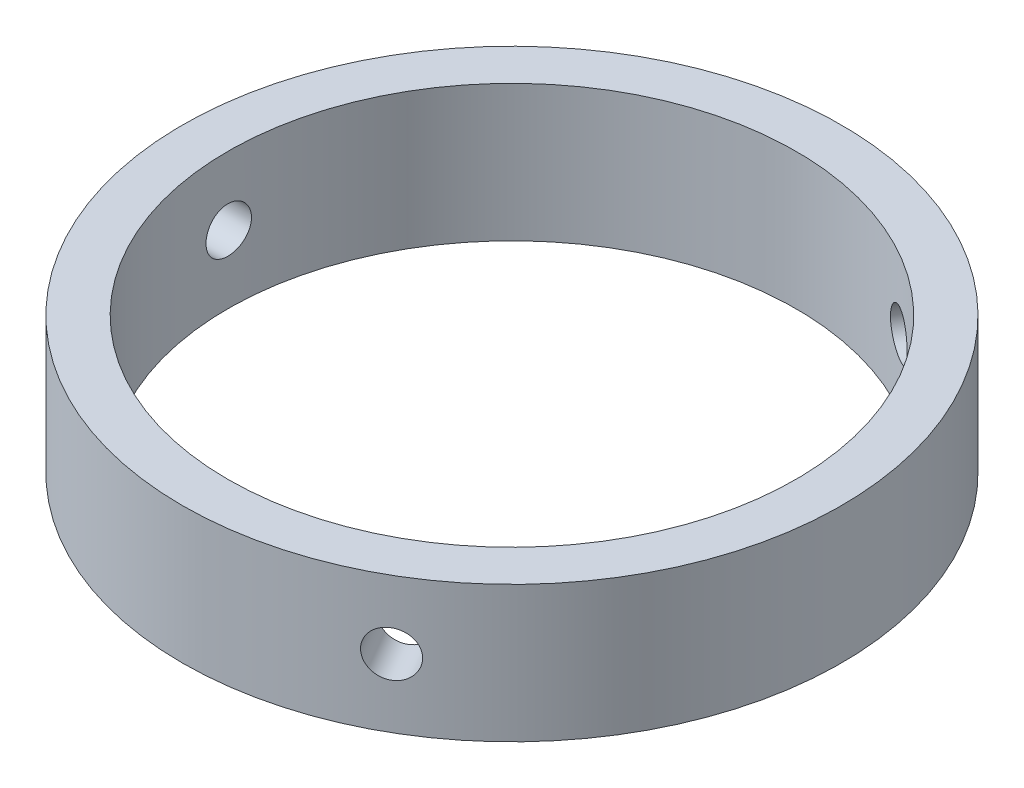
from build123d import *

# Parameters (mm, degrees)
SKETCH1_R           = 46.0375
SKETCH1_R_2         = 39.6875
BOSS_EXTRUDE1_DEPTH = 19.05
SKETCH4_R           = 3.175
CUT_EXTRUDE1_DEPTH  = 76.2
SKETCH5_R           = 3.175
CUT_EXTRUDE2_DEPTH  = 76.2
SKETCH3_R           = 3.175
CUT_EXTRUDE3_DEPTH  = 76.2


with BuildPart() as part:
    # Sketch1 → Boss-Extrude1 (new body)
    with BuildSketch(Plane(origin=(0, 0, 0), x_dir=(1, 0, 0), z_dir=(0, 1, 0))):
        with Locations(Location((0, 0, 0), (0, 0, 90))):
            Circle(SKETCH1_R)
        with Locations(Location((0, 0, 0), (0, 0, 90))):
            Circle(SKETCH1_R_2, mode=Mode.SUBTRACT)
    extrude(amount=BOSS_EXTRUDE1_DEPTH)

    # Sketch4 → Cut-Extrude1 (cut)
    with BuildSketch(Plane(origin=(0, 0, 0), x_dir=(0.8660254037844364, 0, 0.500000000000004), z_dir=(-0.500000000000004, 0, 0.8660254037844365))):
        with Locations((0, 9.525)):
            Circle(SKETCH4_R)
    extrude(amount=-CUT_EXTRUDE1_DEPTH, mode=Mode.SUBTRACT)

    # Sketch5 → Cut-Extrude2 (cut)
    with BuildSketch(Plane(origin=(0, 0, 0), x_dir=(-0.8660254037844363, 0, 0.5000000000000043), z_dir=(-0.5000000000000043, 0, -0.8660254037844363))):
        with Locations((0, 9.525)):
            Circle(SKETCH5_R)
    extrude(amount=-CUT_EXTRUDE2_DEPTH, mode=Mode.SUBTRACT)

    # Sketch3 → Cut-Extrude3 (cut)
    with BuildSketch(Plane(origin=(0, 0, 0), x_dir=(0, 0, -1), z_dir=(1, 0, 0))):
        with Locations((0, 9.525)):
            Circle(SKETCH3_R)
    extrude(amount=-CUT_EXTRUDE3_DEPTH, mode=Mode.SUBTRACT)


solid = part.part
